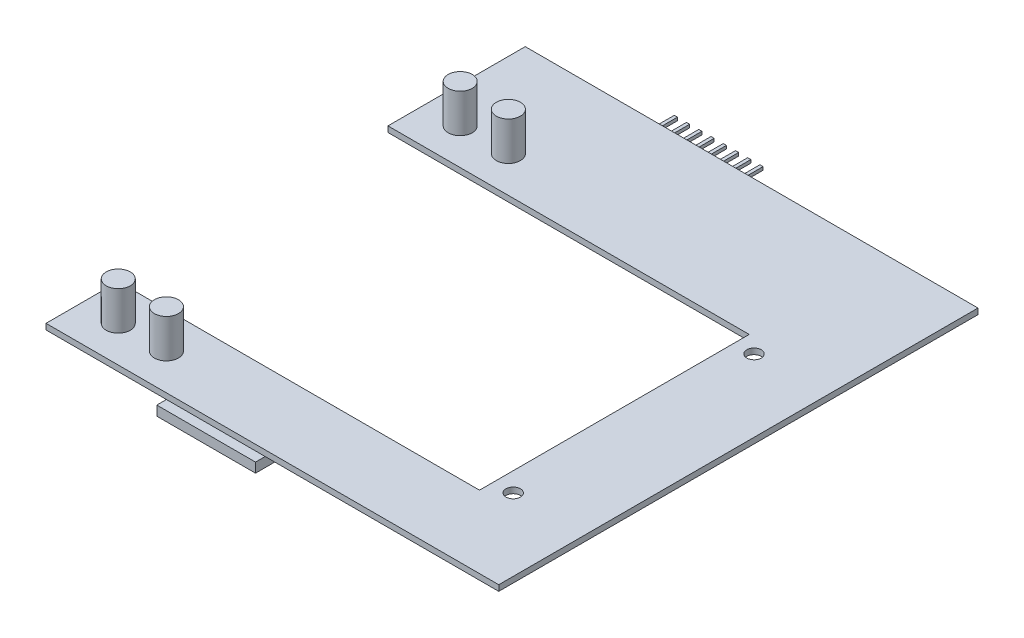
from build123d import *

# Parameters (mm, degrees)
DODANIE_WYCI_GNI_CIE1_DEPTH = 1.2
SZKIC3_R                    = 2.5
DODANIE_WYCI_GNI_CIE2_DEPTH = 8
SZKIC4_R                    = 1.5
WYTNIJ_WYCI_GNI_CIE1_DEPTH  = 706.226503642
SZKIC5_W                    = 5
SZKIC5_H                    = 5
DODANIE_WYCI_GNI_CIE3_DEPTH = 1
SZKIC6_W                    = 8
SZKIC6_H                    = 8
DODANIE_WYCI_GNI_CIE4_DEPTH = 3
SZKIC7_R                    = 2.5
DODANIE_WYCI_GNI_CIE5_DEPTH = 3
SZKIC8_W                    = 20.5
SZKIC8_H                    = 4
SZKIC8_H_2                  = 10
DODANIE_WYCI_GNI_CIE6_DEPTH = 2
SZKIC9_W                    = 0.66
SZKIC9_H                    = 0.66
DODANIE_WYCI_GNI_CIE7_DEPTH = 6
SZYK_LINIOWY1_COUNT         = 8
SZYK_LINIOWY1_PITCH         = 2.54
SZKIC10_W                   = 10
SZKIC10_H                   = 12
SZKIC10_W_2                 = 5
DODANIE_WYCI_GNI_CIE8_DEPTH = 2


with BuildPart() as part:
    # Szkic2 → Dodanie-wyciągnięcie1 (new body)
    with BuildSketch(Plane(origin=(0, 566.370308932, 0), x_dir=(1, 0, 0), z_dir=(0, 1, 0))):
        Polygon((-513.826446608, 398.472881439), (-513.826446608, 383.472881439), (-419.826446608, 383.472881439), (-419.826446608, 482.972881439), (-513.826446608, 482.972881439), (-513.826446608, 454.472881439), (-438.826446608, 454.472881439), (-438.826446608, 398.472881439), align=None)
    extrude(amount=DODANIE_WYCI_GNI_CIE1_DEPTH)

    # Szkic3 → Dodanie-wyciągnięcie2 (add)
    with BuildSketch(Plane(origin=(0, 567.570308932, 0), x_dir=(1, 0, 0), z_dir=(0, 1, 0))):
        with Locations(Location((-506.326446608, 461.972881439, 0), (0, 0, 180))):
            Circle(SZKIC3_R)
        with Locations(Location((-496.326446608, 461.972881439, 0), (0, 0, 180))):
            Circle(SZKIC3_R)
        with Locations(Location((-496.326446608, 390.972881439, 0), (0, 0, 180))):
            Circle(SZKIC3_R)
        with Locations(Location((-506.326446608, 390.972881439, 0), (0, 0, 180))):
            Circle(SZKIC3_R)
    extrude(amount=DODANIE_WYCI_GNI_CIE2_DEPTH)

    # Szkic4 → Wytnij-wyciągnięcie1 (cut, through all)
    with BuildSketch(Plane(origin=(0, 567.570308932, 0), x_dir=(1, 0, 0), z_dir=(0, 1, 0))):
        with Locations(Location((-434.826446608, 401.472881439, 0), (0, 0, 180))):
            Circle(SZKIC4_R)
        with Locations(Location((-434.826446608, 451.472881439, 0), (0, 0, 180))):
            Circle(SZKIC4_R)
    extrude(amount=-WYTNIJ_WYCI_GNI_CIE1_DEPTH, mode=Mode.SUBTRACT)

    # Szkic5 → Dodanie-wyciągnięcie3 (add)
    with BuildSketch(Plane.XZ.offset(-566.370308932)):
        with Locations((-506.326446608, -475.472881439)):
            Rectangle(SZKIC5_W, SZKIC5_H)
        with Locations((-496.326446608, -475.472881439)):
            Rectangle(SZKIC5_W, SZKIC5_H)
    extrude(amount=DODANIE_WYCI_GNI_CIE3_DEPTH)

    # Szkic6 → Dodanie-wyciągnięcie4 (add)
    with BuildSketch(Plane(origin=(0, 566.370308932, 0), x_dir=(-1, 0, 0), z_dir=(0, -1, 0))):
        with Locations((479.826446608, 463.972881439)):
            Rectangle(SZKIC6_W, SZKIC6_H)
    extrude(amount=DODANIE_WYCI_GNI_CIE4_DEPTH)

    # Szkic7 → Dodanie-wyciągnięcie5 (add)
    with BuildSketch(Plane.XZ.offset(-563.370308932)):
        with Locations(Location((-479.826446608, -463.972881439, 0), (0, 0, 270))):
            Circle(SZKIC7_R)
    extrude(amount=DODANIE_WYCI_GNI_CIE5_DEPTH)

    # Szkic8 → Dodanie-wyciągnięcie6 (add)
    with BuildSketch(Plane(origin=(0, 566.370308932, 0), x_dir=(-1, 0, 0), z_dir=(0, -1, 0))):
        with Locations((478.576446608, 479.972881439)):
            Rectangle(SZKIC8_W, SZKIC8_H)
        with Locations((478.576446608, 386.472881439)):
            Rectangle(SZKIC8_W, SZKIC8_H_2)
    extrude(amount=DODANIE_WYCI_GNI_CIE6_DEPTH)

    # Szkic9 → Dodanie-wyciągnięcie7 (add)
    with BuildSketch(Plane(origin=(0, 0, -481.972881439), x_dir=(-1, 0, 0), z_dir=(0, 0, -1))):
        with Locations((487.556446608, 565.360308932)):
            Rectangle(SZKIC9_W, SZKIC9_H)
    dodanie_wyci_gni_cie7 = extrude(amount=DODANIE_WYCI_GNI_CIE7_DEPTH)

    # Szyk liniowy1: Dodanie-wyciągnięcie7 ×8
    with Locations(*[(i * SZYK_LINIOWY1_PITCH, 0, 0) for i in range(1, SZYK_LINIOWY1_COUNT)]):
        add(dodanie_wyci_gni_cie7)

    # Szkic10 → Dodanie-wyciągnięcie8 (add)
    with BuildSketch(Plane(origin=(0, 566.370308932, 0), x_dir=(-1, 0, 0), z_dir=(0, -1, 0))):
        with Locations((458.326446608, 468.972881439)):
            Rectangle(SZKIC10_W, SZKIC10_H)
        with Locations((447.326446608, 468.972881439)):
            Rectangle(SZKIC10_W_2, SZKIC10_H)
    extrude(amount=DODANIE_WYCI_GNI_CIE8_DEPTH)


solid = part.part
